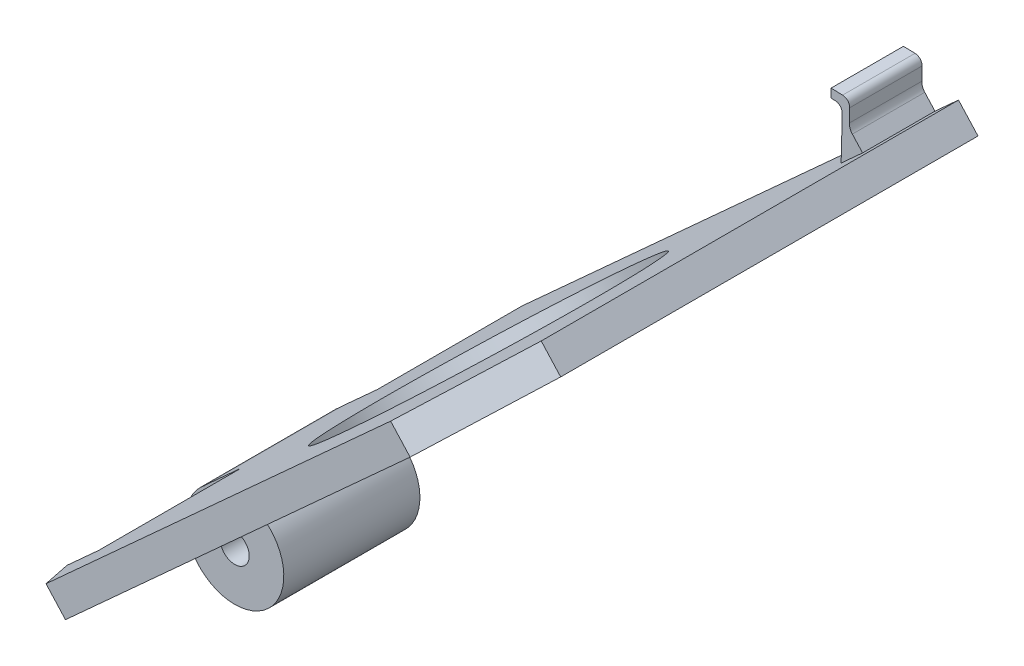
from build123d import *

# Parameters (mm, degrees)
BOSS_EXTRU_1_DEPTH      = 2
ESQUISSE2_R             = 3.390627372
ESQUISSE2_R_2           = 1
BOSS_EXTRU_2_DEPTH      = 9.4
ESQUISSE3_R             = 10
ENL_V_MAT_EXTRU_1_DEPTH = 2
BOSS_EXTRU_4_DEPTH      = 5


with BuildPart() as part:
    # Esquisse1 → Boss.-Extru.1 (new body)
    with BuildSketch(Plane(origin=(-56.095259607, 61.741123985, 0), x_dir=(0, 0, 1), z_dir=(0.6724559427452335, -0.7401371528754785, 0))):
        Polygon((-13.170985067, 24.825265138), (-13.170985067, 56.986737001), (-18.722825356, 62.53857729), (-18.722825356, 59.57280759), (-28.570985067, 59.57280759), (-28.570985067, 62.962841359), (-37.970985067, 62.962841359), (-37.970985067, 59.57280759), (-47.970985067, 59.57280759), (-47.970985067, 18.84916078), (-19.147089425, 18.84916078), align=None)
    extrude(amount=-BOSS_EXTRU_1_DEPTH)

    # Esquisse2 → Boss.-Extru.2 (add)
    with BuildSketch(Plane(origin=(0, 0, -37.970985067), x_dir=(-1, 0, 0), z_dir=(0, 0, -1))):
        with Locations((101.983702424, 18.170834722)):
            Circle(ESQUISSE2_R)
        with Locations((101.983702424, 18.170834722)):
            Circle(ESQUISSE2_R_2, mode=Mode.SUBTRACT)
    extrude(amount=-BOSS_EXTRU_2_DEPTH)

    # Esquisse3 → Enlèv. mat.-Extru.1 (cut)
    with BuildSketch(Plane(origin=(-56.095259607, 61.741123985, 0), x_dir=(0, 0, -1), z_dir=(0.6724559427452331, -0.7401371528754788, 0))):
        with Locations(Location((30.570985067, -39.210984185, 0), (0, 0, 90))):
            Circle(ESQUISSE3_R)
    extrude(amount=-ENL_V_MAT_EXTRU_1_DEPTH, mode=Mode.SUBTRACT)

    # Esquisse4 → Boss.-Extru.4 (add)
    with BuildSketch(Plane(origin=(0, 0, -47.970985067), x_dir=(-1, 0, 0), z_dir=(0, 0, -1))):
        with BuildLine():
            Line((73.931199041, 50.400140176), (73.907590469, 51.325240797))
            ThreePointArc((73.907590469, 51.325240797), (74.044969666, 51.682415216), (74.394671882, 51.837833908))
            Line((74.394671882, 51.837833908), (75.194671882, 51.858249912))
            Line((75.194671882, 51.858249912), (75.209983884, 51.258249912))
            Line((75.209983884, 51.258249912), (74.909821146, 51.250589757))
            ThreePointArc((74.909821146, 51.250589757), (74.560118931, 51.095171065), (74.422739734, 50.737996646))
            Line((74.422739734, 50.737996646), (74.499711728, 47.721853148))
            Line((74.499711728, 47.721853148), (73.019437422, 49.066765034))
            Line((73.019437422, 49.066765034), (73.723569144, 49.841766063))
            ThreePointArc((73.723569144, 49.841766063), (73.881297111, 50.10090571), (73.931199041, 50.400140176))
        make_face()
    extrude(amount=-BOSS_EXTRU_4_DEPTH)


solid = part.part
